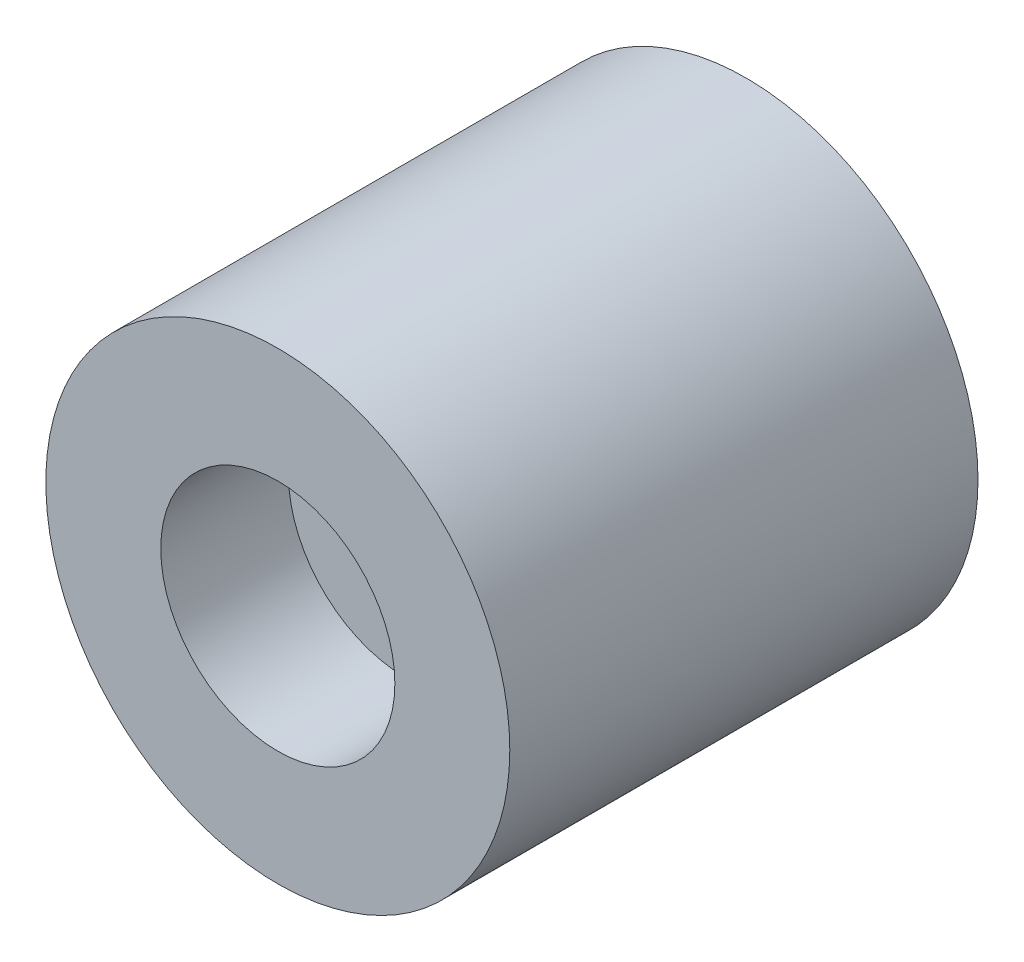
from build123d import *

# Parameters (mm, degrees)
SKETCH1_R           = 5.45
BOSS_EXTRUDE1_DEPTH = 11
SKETCH2_R           = 2.75
CUT_EXTRUDE1_DEPTH  = 3


with BuildPart() as part:
    # Sketch1 → Boss-Extrude1 (new body)
    with BuildSketch(Plane.XY):
        Circle(SKETCH1_R)
    extrude(amount=BOSS_EXTRUDE1_DEPTH)

    # Sketch2 → Cut-Extrude1 (cut)
    with BuildSketch(Plane.XY.offset(11)):
        Circle(SKETCH2_R)
    extrude(amount=-CUT_EXTRUDE1_DEPTH, mode=Mode.SUBTRACT)


solid = part.part
